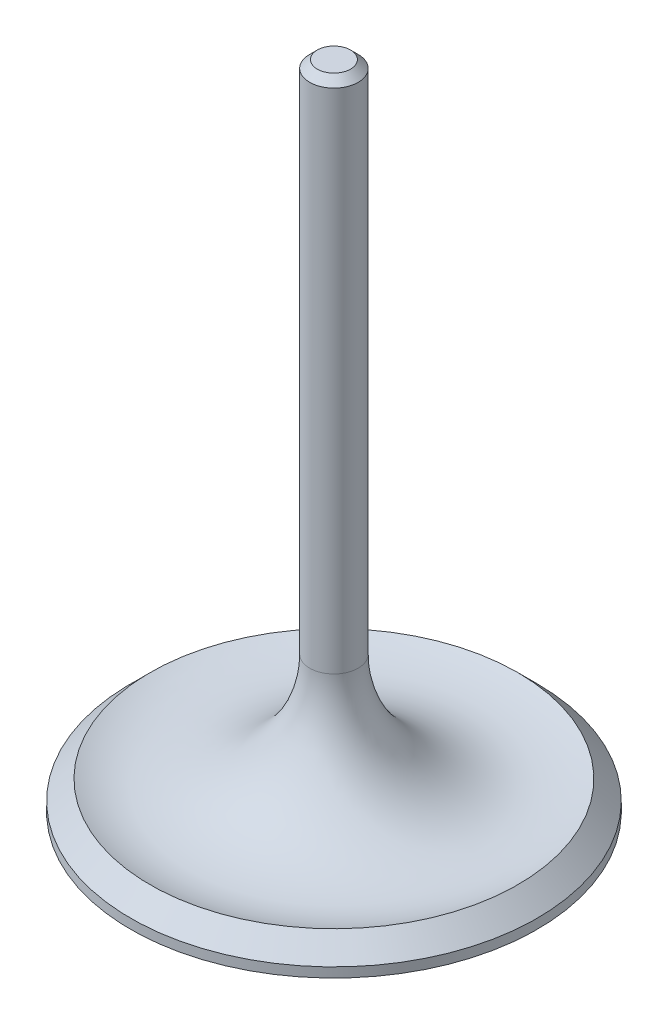
from build123d import *

# Parameters (mm, degrees)
CHAMFER1_SIZE = 1


with BuildPart() as part:
    # Sketch1 → Revolve1 (revolve)
    with BuildSketch(Plane.XY, mode=Mode.PRIVATE) as revolve1_sk:
        with BuildLine():
            Line((0, 0), (0, 85.55))
            Line((0, 85.55), (3.18, 85.55))
            Line((3.18, 85.55), (3.18, 17.954698654))
            ThreePointArc((3.18, 17.954698654), (9.896609701, 5.315721242), (24.13, 3.81))
            Line((24.13, 3.81), (26.67, 1.27))
            Line((26.67, 1.27), (26.67, 0))
            Line((26.67, 0), (0, 0))
        make_face()
    revolve(revolve1_sk.sketch.rotate(Axis((0, 0, 0), (0, 1, 0)), 90), axis=Axis((0, 0, 0), (0, 1, 0)))

    # Chamfer1
    chamfer1_edges = [part.edges().sort_by_distance(p)[0] for p in [
        (0, 85.55, 3.18),
    ]]
    chamfer(chamfer1_edges, length=CHAMFER1_SIZE)


solid = part.part
